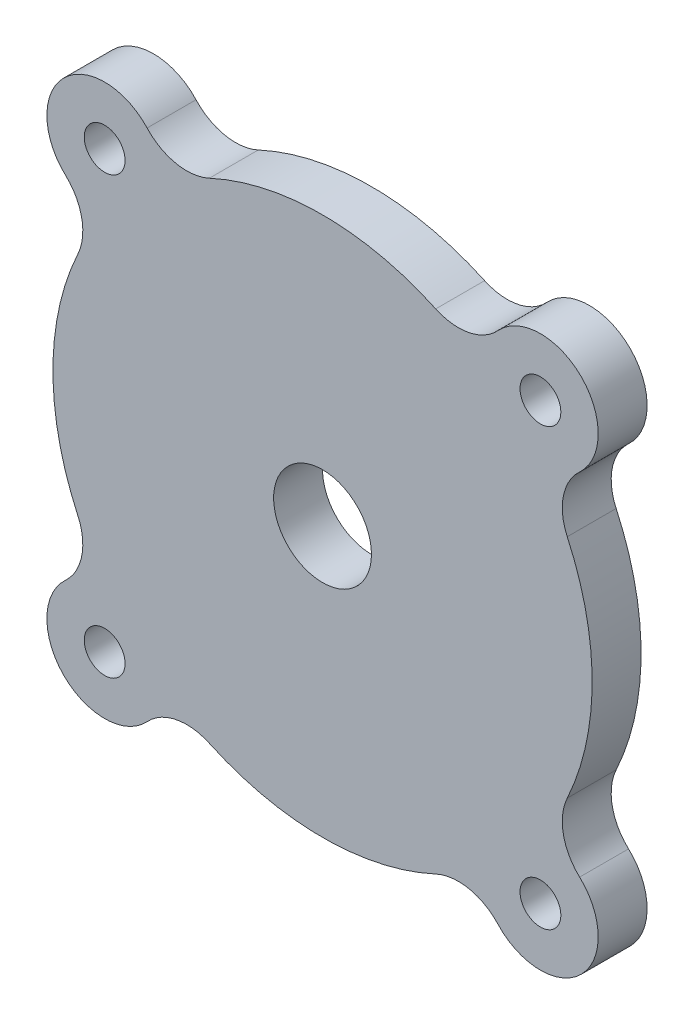
from build123d import *

# Parameters (mm, degrees)
BOSS_EXTRUDE1_DEPTH      = 3.175
FILLET1_R                = 7
M5_CLEARANCE_HOLE1_D     = 5.3
M5_CLEARANCE_HOLE1_DEPTH = 6.35
M5_CLEARANCE_HOLE1_TIP   = 1.59228064
SKETCH4_R                = 6.35
CUT_EXTRUDE1_DEPTH       = 52.003437659


with BuildPart() as part:
    # Sketch1 → Boss-Extrude1 (new, symmetric)
    with BuildSketch(Plane.XY):
        with BuildLine():
            ThreePointArc((-20.785305148, 28.159742362), (-33.587572106, 33.587572106), (-28.159742362, 20.785305148))
            ThreePointArc((-28.159742362, 20.785305148), (-35, 0), (-28.159742362, -20.785305148))
            ThreePointArc((-28.159742362, -20.785305148), (-33.587572106, -33.587572106), (-20.785305148, -28.159742362))
            ThreePointArc((-20.785305148, -28.159742362), (0, -35), (20.785305148, -28.159742362))
            ThreePointArc((20.785305148, -28.159742362), (33.587572106, -33.587572106), (28.159742362, -20.785305148))
            ThreePointArc((28.159742362, -20.785305148), (35, 0), (28.159742362, 20.785305148))
            ThreePointArc((28.159742362, 20.785305148), (33.587572106, 33.587572106), (20.785305148, 28.159742362))
            ThreePointArc((20.785305148, 28.159742362), (0, 35), (-20.785305148, 28.159742362))
        make_face()
    extrude(amount=BOSS_EXTRUDE1_DEPTH, both=True)

    # Fillet1
    fillet1_edges = [part.edges().sort_by_distance(p)[0] for p in [
        (20.785305148, 28.159742362, 0),
        (28.159742362, 20.785305148, 0),
        (28.159742362, -20.785305148, 0),
        (20.785305148, -28.159742362, 0),
        (-20.785305148, -28.159742362, 0),
        (-28.159742362, -20.785305148, 0),
        (-28.159742362, 20.785305148, 0),
        (-20.785305148, 28.159742362, 0),
    ]]
    fillet(fillet1_edges, radius=FILLET1_R)

    # M5 Clearance Hole1
    with Locations(Plane.XY.offset(3.175)):
        with Locations((-28.284271247, 28.284271247), (28.284271247, 28.284271247), (28.284271247, -28.284271247), (-28.284271247, -28.284271247)):
            Hole(M5_CLEARANCE_HOLE1_D / 2, depth=M5_CLEARANCE_HOLE1_DEPTH)
            with Locations((0, 0, -(M5_CLEARANCE_HOLE1_DEPTH + M5_CLEARANCE_HOLE1_TIP / 2))):  # 118° drill point
                Cone(0, M5_CLEARANCE_HOLE1_D / 2, M5_CLEARANCE_HOLE1_TIP, mode=Mode.SUBTRACT)

    # Sketch4 → Cut-Extrude1 (cut, through all)
    with BuildSketch(Plane.XY.offset(3.175)):
        Circle(SKETCH4_R)
    extrude(amount=-CUT_EXTRUDE1_DEPTH, mode=Mode.SUBTRACT)


solid = part.part
